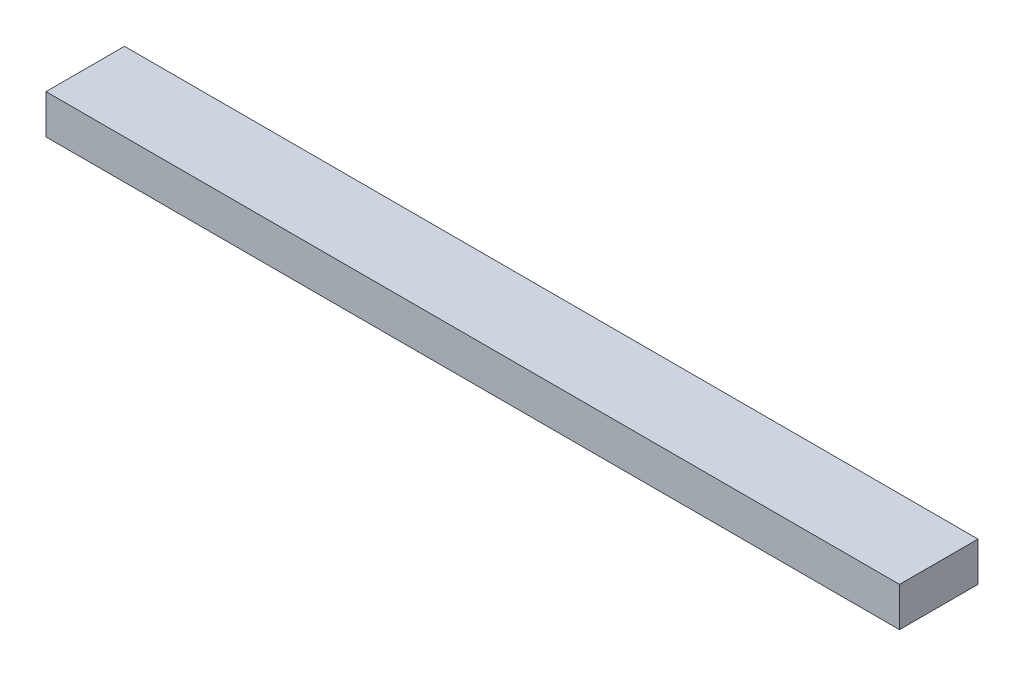
from build123d import *

# Parameters (mm, degrees)
SKETCH1_W           = 552.45
SKETCH1_H           = 50.8
BOSS_EXTRUDE1_DEPTH = 25.4


with BuildPart() as part:
    # Sketch1 → Boss-Extrude1 (new body)
    with BuildSketch(Plane(origin=(0, 0, 0), x_dir=(1, 0, 0), z_dir=(0, 1, 0))):
        Rectangle(SKETCH1_W, SKETCH1_H)
    extrude(amount=BOSS_EXTRUDE1_DEPTH)


solid = part.part
